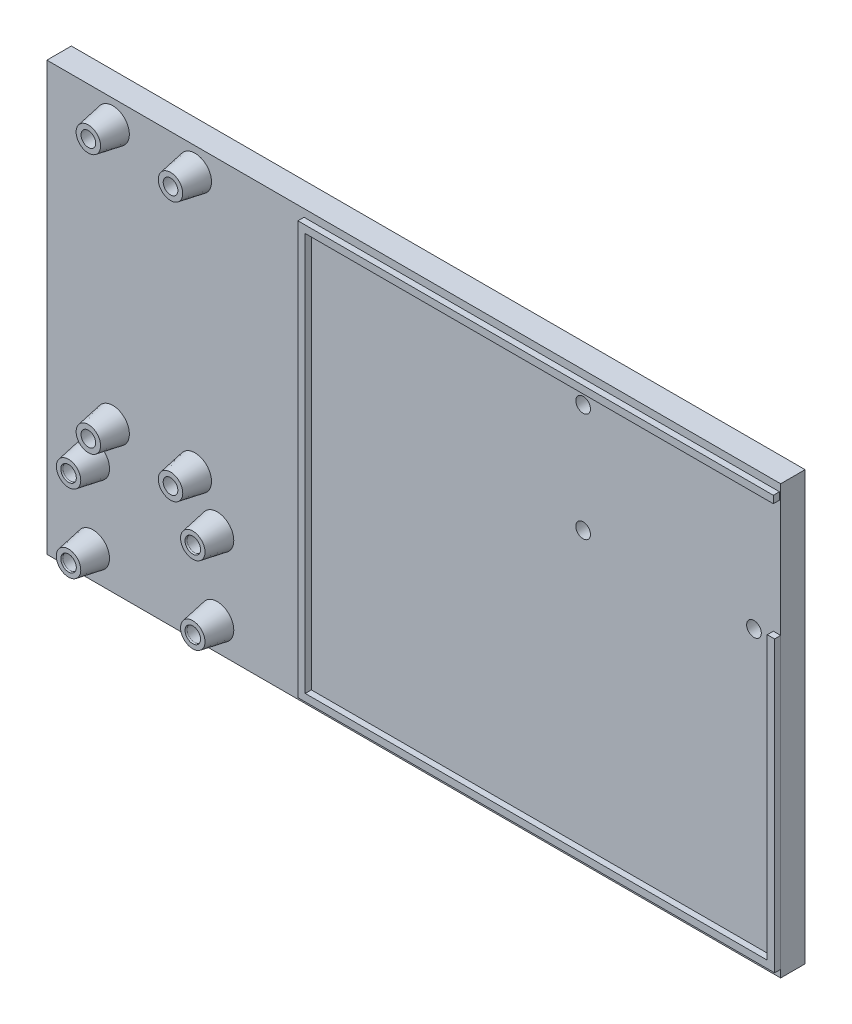
from build123d import *

# Parameters (mm, degrees)
SKETCH1_W                     = 120
SKETCH1_H                     = 70
BOSS_EXTRUDE1_DEPTH           = 4
BOSS_EXTRUDE3_DEPTH           = 1
BOSS_EXTRUDE4_START           = 4
SKETCH4_R                     = 2
SKETCH4_R_2                   = 1.27
BOSS_EXTRUDE4_DEPTH           = 5
BOSS_EXTRUDE4_DRAFT           = 10
BOSS_EXTRUDE4_PROFILE_2_DEPTH = 5
BOSS_EXTRUDE4_PROFILE_2_DRAFT = 10
BOSS_EXTRUDE4_PROFILE_3_DEPTH = 5
BOSS_EXTRUDE4_PROFILE_3_DRAFT = 10
BOSS_EXTRUDE4_PROFILE_4_DEPTH = 5
BOSS_EXTRUDE4_PROFILE_4_DRAFT = 10
SKETCH4_R_3                   = 1.1
BOSS_EXTRUDE4_PROFILE_5_DEPTH = 5
BOSS_EXTRUDE4_PROFILE_5_DRAFT = 10
BOSS_EXTRUDE4_PROFILE_6_DEPTH = 5
BOSS_EXTRUDE4_PROFILE_6_DRAFT = 10
BOSS_EXTRUDE4_PROFILE_7_DEPTH = 5
BOSS_EXTRUDE4_PROFILE_7_DRAFT = 10
BOSS_EXTRUDE4_PROFILE_8_DEPTH = 5
BOSS_EXTRUDE4_PROFILE_8_DRAFT = 10
SKETCH5_R                     = 1.2
CUT_EXTRUDE1_DEPTH            = 70.927391264
CUT_EXTRUDE1_DRAFT            = 4
CUT_EXTRUDE1_PROFILE_2_DEPTH  = 70.927391264
CUT_EXTRUDE1_PROFILE_2_DRAFT  = 4
CUT_EXTRUDE1_PROFILE_3_DEPTH  = 70.927391264
CUT_EXTRUDE1_PROFILE_3_DRAFT  = 4
CUT_EXTRUDE1_PROFILE_4_DEPTH  = 70.927391264
CUT_EXTRUDE1_PROFILE_4_DRAFT  = 4
CUT_EXTRUDE1_PROFILE_5_DEPTH  = 70.927391264
CUT_EXTRUDE1_PROFILE_5_DRAFT  = 4
CUT_EXTRUDE1_PROFILE_6_DEPTH  = 70.927391264
CUT_EXTRUDE1_PROFILE_6_DRAFT  = 4
CUT_EXTRUDE1_PROFILE_7_DEPTH  = 70.927391264
CUT_EXTRUDE1_PROFILE_7_DRAFT  = 4
CUT_EXTRUDE1_PROFILE_8_DEPTH  = 70.927391264
CUT_EXTRUDE1_PROFILE_8_DRAFT  = 4
SKETCH6_R                     = 1.2
CUT_EXTRUDE2_DEPTH            = 70.583331689
CUT_EXTRUDE2_DRAFT            = 5
CUT_EXTRUDE2_PROFILE_2_DEPTH  = 70.583331689
CUT_EXTRUDE2_PROFILE_2_DRAFT  = 5
CUT_EXTRUDE2_PROFILE_3_DEPTH  = 70.583331689
CUT_EXTRUDE2_PROFILE_3_DRAFT  = 5


with BuildPart() as part:
    # Sketch1 → Boss-Extrude1 (new body)
    with BuildSketch(Plane.XY):
        Rectangle(SKETCH1_W, SKETCH1_H)
    extrude(amount=BOSS_EXTRUDE1_DEPTH)

    # Sketch3 → Boss-Extrude3 (add)
    with BuildSketch(Plane.XY.offset(4)):
        Polygon((59.807, 33.7715), (-17.95, 33.7715), (-17.95, -33.7715), (60.007, -33.7715), (60.007, 13.5255), (58.807, 13.5255), (58.807, -32.5715), (-16.75, -32.5715), (-16.75, 32.5715), (59.807, 32.5715), align=None)
    extrude(amount=BOSS_EXTRUDE3_DEPTH)


with BuildPart() as boss_extrude4_tool:
    # Sketch4 → Boss-Extrude4 (with draft: the straight prism first)
    with BuildSketch(Plane.XY.offset(4).offset(BOSS_EXTRUDE4_START)):
        with Locations((-52.46, -17.76)):
            Circle(SKETCH4_R)
        with Locations((-52.46, -17.76)):
            Circle(SKETCH4_R_2, mode=Mode.SUBTRACT)
    extrude(amount=-BOSS_EXTRUDE4_DEPTH)
    # Boss-Extrude4: the draft: its side faces are tilted about the plane it starts from
    boss_extrude4_sides = [boss_extrude4_tool.faces().sort_by_distance(p)[0] for p in [
        (-54.46, -17.76, 5.5),
        (-53.73, -17.76, 5.5),
    ]]
    draft(boss_extrude4_sides, Plane.XY.offset(4).offset(BOSS_EXTRUDE4_START), BOSS_EXTRUDE4_DRAFT)


with BuildPart() as part_1:
    add(part.part)

    # Boss-Extrude4: add boss_extrude4_tool
    add(boss_extrude4_tool.part)


with BuildPart() as boss_extrude4_profile_2_tool:
    # Sketch4 → Boss-Extrude4 profile 2 (with draft: the straight prism first)
    with BuildSketch(Plane.XY.offset(4).offset(BOSS_EXTRUDE4_START)):
        with Locations((-32.14, -17.76)):
            Circle(SKETCH4_R)
        with Locations((-32.14, -17.76)):
            Circle(SKETCH4_R_2, mode=Mode.SUBTRACT)
    extrude(amount=-BOSS_EXTRUDE4_PROFILE_2_DEPTH)
    # Boss-Extrude4 profile 2: the draft: its side faces are tilted about the plane it starts from
    boss_extrude4_profile_2_sides = [boss_extrude4_profile_2_tool.faces().sort_by_distance(p)[0] for p in [
        (-34.14, -17.76, 5.5),
        (-33.41, -17.76, 5.5),
    ]]
    draft(boss_extrude4_profile_2_sides, Plane.XY.offset(4).offset(BOSS_EXTRUDE4_START), BOSS_EXTRUDE4_PROFILE_2_DRAFT)


with BuildPart() as part_2:
    add(part_1.part)

    # Boss-Extrude4 profile 2: add boss_extrude4_profile_2_tool
    add(boss_extrude4_profile_2_tool.part)


with BuildPart() as boss_extrude4_profile_3_tool:
    # Sketch4 → Boss-Extrude4 profile 3 (with draft: the straight prism first)
    with BuildSketch(Plane.XY.offset(4).offset(BOSS_EXTRUDE4_START)):
        with Locations((-52.46, -30.46)):
            Circle(SKETCH4_R)
        with Locations((-52.46, -30.46)):
            Circle(SKETCH4_R_2, mode=Mode.SUBTRACT)
    extrude(amount=-BOSS_EXTRUDE4_PROFILE_3_DEPTH)
    # Boss-Extrude4 profile 3: the draft: its side faces are tilted about the plane it starts from
    boss_extrude4_profile_3_sides = [boss_extrude4_profile_3_tool.faces().sort_by_distance(p)[0] for p in [
        (-54.46, -30.46, 5.5),
        (-53.73, -30.46, 5.5),
    ]]
    draft(boss_extrude4_profile_3_sides, Plane.XY.offset(4).offset(BOSS_EXTRUDE4_START), BOSS_EXTRUDE4_PROFILE_3_DRAFT)


with BuildPart() as part_3:
    add(part_2.part)

    # Boss-Extrude4 profile 3: add boss_extrude4_profile_3_tool
    add(boss_extrude4_profile_3_tool.part)


with BuildPart() as boss_extrude4_profile_4_tool:
    # Sketch4 → Boss-Extrude4 profile 4 (with draft: the straight prism first)
    with BuildSketch(Plane.XY.offset(4).offset(BOSS_EXTRUDE4_START)):
        with Locations((-32.14, -30.46)):
            Circle(SKETCH4_R)
        with Locations((-32.14, -30.46)):
            Circle(SKETCH4_R_2, mode=Mode.SUBTRACT)
    extrude(amount=-BOSS_EXTRUDE4_PROFILE_4_DEPTH)
    # Boss-Extrude4 profile 4: the draft: its side faces are tilted about the plane it starts from
    boss_extrude4_profile_4_sides = [boss_extrude4_profile_4_tool.faces().sort_by_distance(p)[0] for p in [
        (-34.14, -30.46, 5.5),
        (-33.41, -30.46, 5.5),
    ]]
    draft(boss_extrude4_profile_4_sides, Plane.XY.offset(4).offset(BOSS_EXTRUDE4_START), BOSS_EXTRUDE4_PROFILE_4_DRAFT)


with BuildPart() as part_4:
    add(part_3.part)

    # Boss-Extrude4 profile 4: add boss_extrude4_profile_4_tool
    add(boss_extrude4_profile_4_tool.part)


with BuildPart() as boss_extrude4_profile_5_tool:
    # Sketch4 → Boss-Extrude4 profile 5 (with draft: the straight prism first)
    with BuildSketch(Plane.XY.offset(4).offset(BOSS_EXTRUDE4_START)):
        with Locations((-49.22, 31.22)):
            Circle(SKETCH4_R)
        with Locations((-49.22, 31.22)):
            Circle(SKETCH4_R_3, mode=Mode.SUBTRACT)
    extrude(amount=-BOSS_EXTRUDE4_PROFILE_5_DEPTH)
    # Boss-Extrude4 profile 5: the draft: its side faces are tilted about the plane it starts from
    boss_extrude4_profile_5_sides = [boss_extrude4_profile_5_tool.faces().sort_by_distance(p)[0] for p in [
        (-51.22, 31.22, 5.5),
        (-50.32, 31.22, 5.5),
    ]]
    draft(boss_extrude4_profile_5_sides, Plane.XY.offset(4).offset(BOSS_EXTRUDE4_START), BOSS_EXTRUDE4_PROFILE_5_DRAFT)


with BuildPart() as part_5:
    add(part_4.part)

    # Boss-Extrude4 profile 5: add boss_extrude4_profile_5_tool
    add(boss_extrude4_profile_5_tool.part)


with BuildPart() as boss_extrude4_profile_6_tool:
    # Sketch4 → Boss-Extrude4 profile 6 (with draft: the straight prism first)
    with BuildSketch(Plane.XY.offset(4).offset(BOSS_EXTRUDE4_START)):
        with Locations((-35.78, 31.22)):
            Circle(SKETCH4_R)
        with Locations((-35.78, 31.22)):
            Circle(SKETCH4_R_3, mode=Mode.SUBTRACT)
    extrude(amount=-BOSS_EXTRUDE4_PROFILE_6_DEPTH)
    # Boss-Extrude4 profile 6: the draft: its side faces are tilted about the plane it starts from
    boss_extrude4_profile_6_sides = [boss_extrude4_profile_6_tool.faces().sort_by_distance(p)[0] for p in [
        (-37.78, 31.22, 5.5),
        (-36.88, 31.22, 5.5),
    ]]
    draft(boss_extrude4_profile_6_sides, Plane.XY.offset(4).offset(BOSS_EXTRUDE4_START), BOSS_EXTRUDE4_PROFILE_6_DRAFT)


with BuildPart() as part_6:
    add(part_5.part)

    # Boss-Extrude4 profile 6: add boss_extrude4_profile_6_tool
    add(boss_extrude4_profile_6_tool.part)


with BuildPart() as boss_extrude4_profile_7_tool:
    # Sketch4 → Boss-Extrude4 profile 7 (with draft: the straight prism first)
    with BuildSketch(Plane.XY.offset(4).offset(BOSS_EXTRUDE4_START)):
        with Locations((-49.22, -11.22)):
            Circle(SKETCH4_R)
        with Locations((-49.22, -11.22)):
            Circle(SKETCH4_R_3, mode=Mode.SUBTRACT)
    extrude(amount=-BOSS_EXTRUDE4_PROFILE_7_DEPTH)
    # Boss-Extrude4 profile 7: the draft: its side faces are tilted about the plane it starts from
    boss_extrude4_profile_7_sides = [boss_extrude4_profile_7_tool.faces().sort_by_distance(p)[0] for p in [
        (-51.22, -11.22, 5.5),
        (-50.32, -11.22, 5.5),
    ]]
    draft(boss_extrude4_profile_7_sides, Plane.XY.offset(4).offset(BOSS_EXTRUDE4_START), BOSS_EXTRUDE4_PROFILE_7_DRAFT)


with BuildPart() as part_7:
    add(part_6.part)

    # Boss-Extrude4 profile 7: add boss_extrude4_profile_7_tool
    add(boss_extrude4_profile_7_tool.part)


with BuildPart() as boss_extrude4_profile_8_tool:
    # Sketch4 → Boss-Extrude4 profile 8 (with draft: the straight prism first)
    with BuildSketch(Plane.XY.offset(4).offset(BOSS_EXTRUDE4_START)):
        with Locations((-35.78, -11.22)):
            Circle(SKETCH4_R)
        with Locations((-35.78, -11.22)):
            Circle(SKETCH4_R_3, mode=Mode.SUBTRACT)
    extrude(amount=-BOSS_EXTRUDE4_PROFILE_8_DEPTH)
    # Boss-Extrude4 profile 8: the draft: its side faces are tilted about the plane it starts from
    boss_extrude4_profile_8_sides = [boss_extrude4_profile_8_tool.faces().sort_by_distance(p)[0] for p in [
        (-37.78, -11.22, 5.5),
        (-36.88, -11.22, 5.5),
    ]]
    draft(boss_extrude4_profile_8_sides, Plane.XY.offset(4).offset(BOSS_EXTRUDE4_START), BOSS_EXTRUDE4_PROFILE_8_DRAFT)


with BuildPart() as part_8:
    add(part_7.part)

    # Boss-Extrude4 profile 8: add boss_extrude4_profile_8_tool
    add(boss_extrude4_profile_8_tool.part)


with BuildPart() as cut_extrude1_tool:
    # Sketch5 → Cut-Extrude1 (with draft: the straight prism first)
    with BuildSketch(Plane.XY.offset(8)):
        with Locations((-52.46, -17.76)):
            Circle(SKETCH5_R)
    extrude(amount=-CUT_EXTRUDE1_DEPTH)
    # Cut-Extrude1: the draft: its side faces are tilted about the plane it starts from
    cut_extrude1_sides = [cut_extrude1_tool.faces().sort_by_distance(p)[0] for p in [
        (-53.66, -17.76, -27.463695632),
    ]]
    draft(cut_extrude1_sides, Plane.XY.offset(8), CUT_EXTRUDE1_DRAFT)


with BuildPart() as part_9:
    add(part_8.part)

    # Cut-Extrude1: cut by cut_extrude1_tool
    add(cut_extrude1_tool.part, mode=Mode.SUBTRACT)


with BuildPart() as cut_extrude1_profile_2_tool:
    # Sketch5 → Cut-Extrude1 profile 2 (with draft: the straight prism first)
    with BuildSketch(Plane.XY.offset(8)):
        with Locations((-32.14, -17.76)):
            Circle(SKETCH5_R)
    extrude(amount=-CUT_EXTRUDE1_PROFILE_2_DEPTH)
    # Cut-Extrude1 profile 2: the draft: its side faces are tilted about the plane it starts from
    cut_extrude1_profile_2_sides = [cut_extrude1_profile_2_tool.faces().sort_by_distance(p)[0] for p in [
        (-33.34, -17.76, -27.463695632),
    ]]
    draft(cut_extrude1_profile_2_sides, Plane.XY.offset(8), CUT_EXTRUDE1_PROFILE_2_DRAFT)


with BuildPart() as part_10:
    add(part_9.part)

    # Cut-Extrude1 profile 2: cut by cut_extrude1_profile_2_tool
    add(cut_extrude1_profile_2_tool.part, mode=Mode.SUBTRACT)


with BuildPart() as cut_extrude1_profile_3_tool:
    # Sketch5 → Cut-Extrude1 profile 3 (with draft: the straight prism first)
    with BuildSketch(Plane.XY.offset(8)):
        with Locations((-52.46, -30.46)):
            Circle(SKETCH5_R)
    extrude(amount=-CUT_EXTRUDE1_PROFILE_3_DEPTH)
    # Cut-Extrude1 profile 3: the draft: its side faces are tilted about the plane it starts from
    cut_extrude1_profile_3_sides = [cut_extrude1_profile_3_tool.faces().sort_by_distance(p)[0] for p in [
        (-53.66, -30.46, -27.463695632),
    ]]
    draft(cut_extrude1_profile_3_sides, Plane.XY.offset(8), CUT_EXTRUDE1_PROFILE_3_DRAFT)


with BuildPart() as part_11:
    add(part_10.part)

    # Cut-Extrude1 profile 3: cut by cut_extrude1_profile_3_tool
    add(cut_extrude1_profile_3_tool.part, mode=Mode.SUBTRACT)


with BuildPart() as cut_extrude1_profile_4_tool:
    # Sketch5 → Cut-Extrude1 profile 4 (with draft: the straight prism first)
    with BuildSketch(Plane.XY.offset(8)):
        with Locations((-32.14, -30.46)):
            Circle(SKETCH5_R)
    extrude(amount=-CUT_EXTRUDE1_PROFILE_4_DEPTH)
    # Cut-Extrude1 profile 4: the draft: its side faces are tilted about the plane it starts from
    cut_extrude1_profile_4_sides = [cut_extrude1_profile_4_tool.faces().sort_by_distance(p)[0] for p in [
        (-33.34, -30.46, -27.463695632),
    ]]
    draft(cut_extrude1_profile_4_sides, Plane.XY.offset(8), CUT_EXTRUDE1_PROFILE_4_DRAFT)


with BuildPart() as part_12:
    add(part_11.part)

    # Cut-Extrude1 profile 4: cut by cut_extrude1_profile_4_tool
    add(cut_extrude1_profile_4_tool.part, mode=Mode.SUBTRACT)


with BuildPart() as cut_extrude1_profile_5_tool:
    # Sketch5 → Cut-Extrude1 profile 5 (with draft: the straight prism first)
    with BuildSketch(Plane.XY.offset(8)):
        with Locations((-49.22, 31.22)):
            Circle(SKETCH5_R)
    extrude(amount=-CUT_EXTRUDE1_PROFILE_5_DEPTH)
    # Cut-Extrude1 profile 5: the draft: its side faces are tilted about the plane it starts from
    cut_extrude1_profile_5_sides = [cut_extrude1_profile_5_tool.faces().sort_by_distance(p)[0] for p in [
        (-50.42, 31.22, -27.463695632),
    ]]
    draft(cut_extrude1_profile_5_sides, Plane.XY.offset(8), CUT_EXTRUDE1_PROFILE_5_DRAFT)


with BuildPart() as part_13:
    add(part_12.part)

    # Cut-Extrude1 profile 5: cut by cut_extrude1_profile_5_tool
    add(cut_extrude1_profile_5_tool.part, mode=Mode.SUBTRACT)


with BuildPart() as cut_extrude1_profile_6_tool:
    # Sketch5 → Cut-Extrude1 profile 6 (with draft: the straight prism first)
    with BuildSketch(Plane.XY.offset(8)):
        with Locations((-35.78, 31.22)):
            Circle(SKETCH5_R)
    extrude(amount=-CUT_EXTRUDE1_PROFILE_6_DEPTH)
    # Cut-Extrude1 profile 6: the draft: its side faces are tilted about the plane it starts from
    cut_extrude1_profile_6_sides = [cut_extrude1_profile_6_tool.faces().sort_by_distance(p)[0] for p in [
        (-36.98, 31.22, -27.463695632),
    ]]
    draft(cut_extrude1_profile_6_sides, Plane.XY.offset(8), CUT_EXTRUDE1_PROFILE_6_DRAFT)


with BuildPart() as part_14:
    add(part_13.part)

    # Cut-Extrude1 profile 6: cut by cut_extrude1_profile_6_tool
    add(cut_extrude1_profile_6_tool.part, mode=Mode.SUBTRACT)


with BuildPart() as cut_extrude1_profile_7_tool:
    # Sketch5 → Cut-Extrude1 profile 7 (with draft: the straight prism first)
    with BuildSketch(Plane.XY.offset(8)):
        with Locations((-49.22, -11.22)):
            Circle(SKETCH5_R)
    extrude(amount=-CUT_EXTRUDE1_PROFILE_7_DEPTH)
    # Cut-Extrude1 profile 7: the draft: its side faces are tilted about the plane it starts from
    cut_extrude1_profile_7_sides = [cut_extrude1_profile_7_tool.faces().sort_by_distance(p)[0] for p in [
        (-50.42, -11.22, -27.463695632),
    ]]
    draft(cut_extrude1_profile_7_sides, Plane.XY.offset(8), CUT_EXTRUDE1_PROFILE_7_DRAFT)


with BuildPart() as part_15:
    add(part_14.part)

    # Cut-Extrude1 profile 7: cut by cut_extrude1_profile_7_tool
    add(cut_extrude1_profile_7_tool.part, mode=Mode.SUBTRACT)


with BuildPart() as cut_extrude1_profile_8_tool:
    # Sketch5 → Cut-Extrude1 profile 8 (with draft: the straight prism first)
    with BuildSketch(Plane.XY.offset(8)):
        with Locations((-35.78, -11.22)):
            Circle(SKETCH5_R)
    extrude(amount=-CUT_EXTRUDE1_PROFILE_8_DEPTH)
    # Cut-Extrude1 profile 8: the draft: its side faces are tilted about the plane it starts from
    cut_extrude1_profile_8_sides = [cut_extrude1_profile_8_tool.faces().sort_by_distance(p)[0] for p in [
        (-36.98, -11.22, -27.463695632),
    ]]
    draft(cut_extrude1_profile_8_sides, Plane.XY.offset(8), CUT_EXTRUDE1_PROFILE_8_DRAFT)


with BuildPart() as part_16:
    add(part_15.part)

    # Cut-Extrude1 profile 8: cut by cut_extrude1_profile_8_tool
    add(cut_extrude1_profile_8_tool.part, mode=Mode.SUBTRACT)


with BuildPart() as cut_extrude2_tool:
    # Sketch6 → Cut-Extrude2 (with draft: the straight prism first)
    with BuildSketch(Plane.XY.offset(4)):
        with Locations((27.696, 30.0355)):
            Circle(SKETCH6_R)
    extrude(amount=-CUT_EXTRUDE2_DEPTH)
    # Cut-Extrude2: the draft: its side faces are tilted about the plane it starts from
    cut_extrude2_sides = [cut_extrude2_tool.faces().sort_by_distance(p)[0] for p in [
        (26.496, 30.0355, -31.291665845),
    ]]
    draft(cut_extrude2_sides, Plane.XY.offset(4), CUT_EXTRUDE2_DRAFT)


with BuildPart() as part_17:
    add(part_16.part)

    # Cut-Extrude2: cut by cut_extrude2_tool
    add(cut_extrude2_tool.part, mode=Mode.SUBTRACT)


with BuildPart() as cut_extrude2_profile_2_tool:
    # Sketch6 → Cut-Extrude2 profile 2 (with draft: the straight prism first)
    with BuildSketch(Plane.XY.offset(4)):
        with Locations((27.696, 12.2555)):
            Circle(SKETCH6_R)
    extrude(amount=-CUT_EXTRUDE2_PROFILE_2_DEPTH)
    # Cut-Extrude2 profile 2: the draft: its side faces are tilted about the plane it starts from
    cut_extrude2_profile_2_sides = [cut_extrude2_profile_2_tool.faces().sort_by_distance(p)[0] for p in [
        (26.496, 12.2555, -31.291665845),
    ]]
    draft(cut_extrude2_profile_2_sides, Plane.XY.offset(4), CUT_EXTRUDE2_PROFILE_2_DRAFT)


with BuildPart() as part_18:
    add(part_17.part)

    # Cut-Extrude2 profile 2: cut by cut_extrude2_profile_2_tool
    add(cut_extrude2_profile_2_tool.part, mode=Mode.SUBTRACT)


with BuildPart() as cut_extrude2_profile_3_tool:
    # Sketch6 → Cut-Extrude2 profile 3 (with draft: the straight prism first)
    with BuildSketch(Plane.XY.offset(4)):
        with Locations((55.636, 12.2555)):
            Circle(SKETCH6_R)
    extrude(amount=-CUT_EXTRUDE2_PROFILE_3_DEPTH)
    # Cut-Extrude2 profile 3: the draft: its side faces are tilted about the plane it starts from
    cut_extrude2_profile_3_sides = [cut_extrude2_profile_3_tool.faces().sort_by_distance(p)[0] for p in [
        (54.436, 12.2555, -31.291665845),
    ]]
    draft(cut_extrude2_profile_3_sides, Plane.XY.offset(4), CUT_EXTRUDE2_PROFILE_3_DRAFT)


with BuildPart() as part_19:
    add(part_18.part)

    # Cut-Extrude2 profile 3: cut by cut_extrude2_profile_3_tool
    add(cut_extrude2_profile_3_tool.part, mode=Mode.SUBTRACT)


solid = part_19.part
